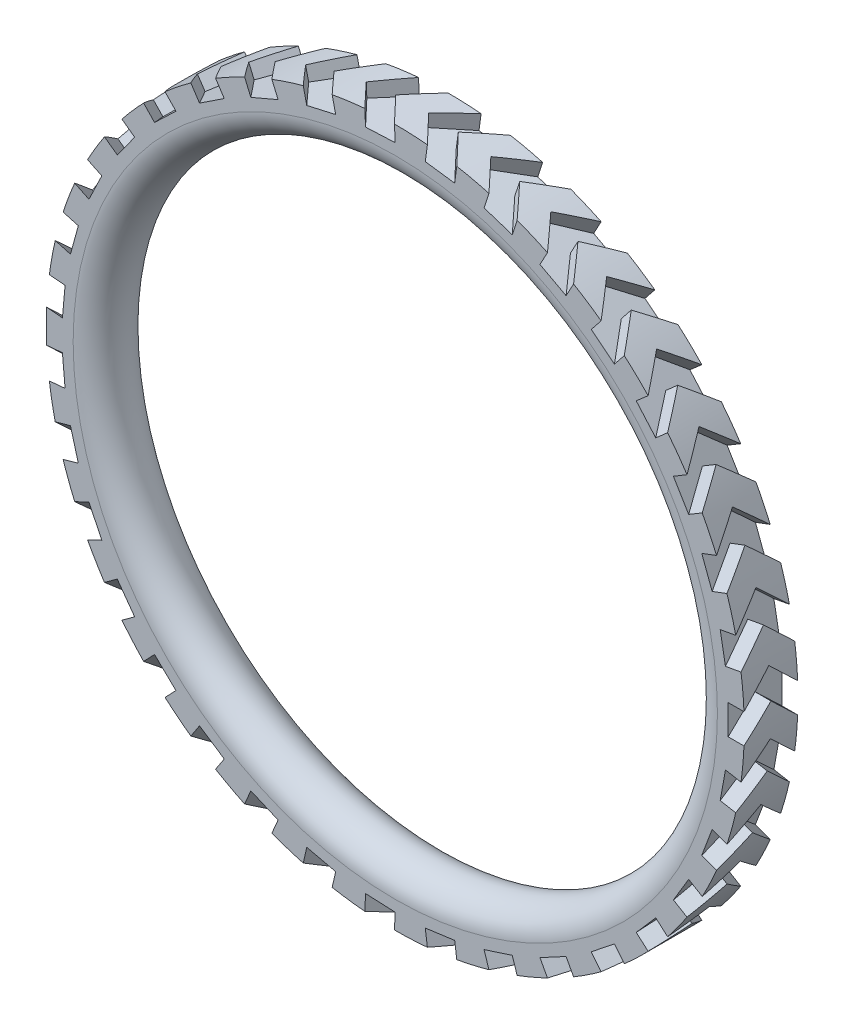
from build123d import *

# Parameters (mm, degrees)
EXTRUS_O1_START        = 31
EXTRUS_O1_DEPTH        = 10
PADR_O_CIRCULAR2_COUNT = 35


with BuildPart() as part:
    # Varredura1: sweep along a path in Esboço1
    with BuildLine(Plane.XY) as varredura1_path:
        CenterArc((0, 0), 30, 0, 360)
    # Esboço2 → Varredura1 (sweep)
    with BuildSketch(Plane(origin=(0, 0, 0), x_dir=(0, 0, -1), z_dir=(1, 0, 0))):
        with BuildLine():
            Line((0, 32.5), (2.5, 32.5))
            Line((2.5, 32.5), (2.5, 30))
            ThreePointArc((2.5, 30), (0, 27.5), (-2.5, 30))
            Line((-2.5, 30), (-2.5, 32.5))
            Line((-2.5, 32.5), (0, 32.5))
        make_face()
    sweep(path=varredura1_path.line)

    # Esboço4 → Extrusão1 (cut)
    with BuildSketch(Plane(origin=(0, 0, 0), x_dir=(0, 0, -1), z_dir=(1, 0, 0)).offset(EXTRUS_O1_START)):
        Polygon((-2.5, -1.380952381), (0, 1), (2.5, -1.380952381), (3.880952381, 0), (2.5, 1.380952381), (0, 3.761904762), (-2.5, 1.380952381), (-3.95, 0), align=None)
    extrus_o1 = extrude(amount=EXTRUS_O1_DEPTH, mode=Mode.SUBTRACT)

    # Padrão circular2: Extrusão1 ×35 about axis
    padr_o_circular2_axis = Axis((0, 0, 0), (0, 0, 1))
    for i in range(1, PADR_O_CIRCULAR2_COUNT):
        add(extrus_o1.rotate(padr_o_circular2_axis, i * 360 / PADR_O_CIRCULAR2_COUNT), mode=Mode.SUBTRACT)


solid = part.part
